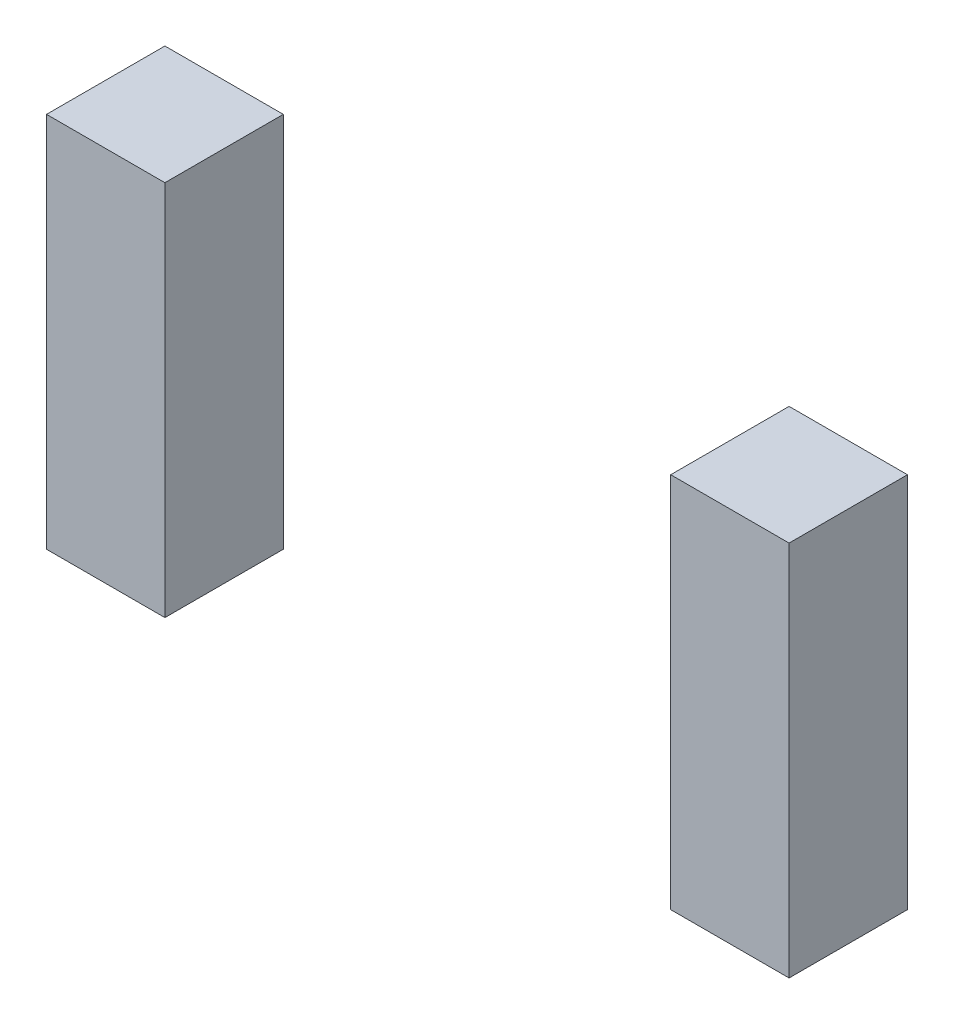
from build123d import *

# Parameters (mm, degrees)
ESQUISSE1_W          = 22
ESQUISSE1_H          = 22
BOSS_EXTRU_1_DEPTH   = 70
BOSS_EXTRU_1_2_DEPTH = 70


with BuildPart() as part:
    # Esquisse1 → Boss.-Extru.1 (new body)
    with BuildSketch(Plane(origin=(0, 0, 0), x_dir=(1, 0, 0), z_dir=(0, 1, 0))):
        with Locations((-39.517705782, 5.642414842)):
            Rectangle(ESQUISSE1_W, ESQUISSE1_H)
    extrude(amount=BOSS_EXTRU_1_DEPTH)


with BuildPart() as body_2:
    # Esquisse1 → Boss.-Extru.1 2 (new body)
    with BuildSketch(Plane(origin=(0, 0, 0), x_dir=(1, 0, 0), z_dir=(0, 1, 0))):
        with Locations((76.482294218, 5.642414842)):
            Rectangle(ESQUISSE1_W, ESQUISSE1_H)
    extrude(amount=BOSS_EXTRU_1_2_DEPTH)


solid = Compound([part.part, body_2.part])
